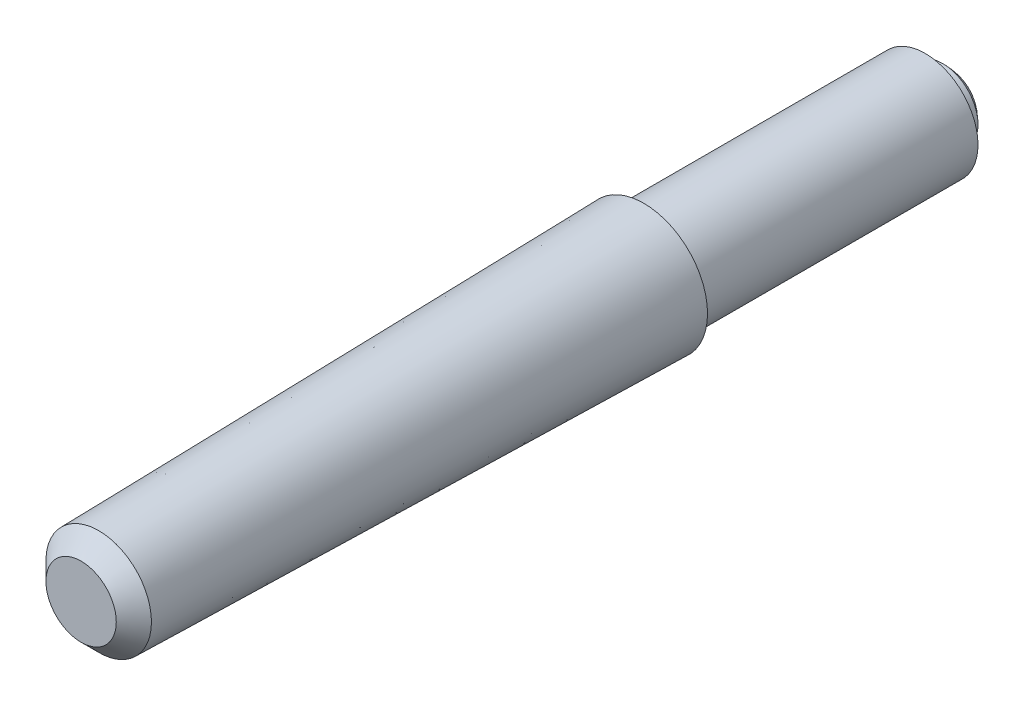
from build123d import *


with BuildPart() as part:
    # Эскиз1 → Повернуть1 (revolve)
    with BuildSketch(Plane(origin=(0, 0, 0), x_dir=(0, 0, -1), z_dir=(1, 0, 0)), mode=Mode.PRIVATE) as revolve_1_sk:
        with BuildLine():
            Line((-39.358214094, 0), (-39.358214094, 2))
            Line((-39.358214094, 2), (-38.358214094, 3))
            Line((-38.358214094, 3), (-7.358214094, 3.62))
            Line((-7.358214094, 3.62), (-7.358214094, 3))
            Line((-7.358214094, 3), (8.641785906, 3))
            Line((8.641785906, 3), (8.641785906, 2))
            Line((8.641785906, 2), (9.641785906, 2))
            add(Edge.make_bspline(
                [(9.641785906, 2), (10.641785906, 1), (10.641785906, 0)],
                knots=[0, 0, 0, 0.5, 0.5, 0.5], degree=2))
            Line((10.641785906, 0), (-39.358214094, 0))
        make_face()
    revolve(revolve_1_sk.sketch.rotate(Axis((0, 0, 39.358214094), (0, 0, -1)), 90), axis=Axis((0, 0, 39.358214094), (0, 0, -1)))


solid = part.part
